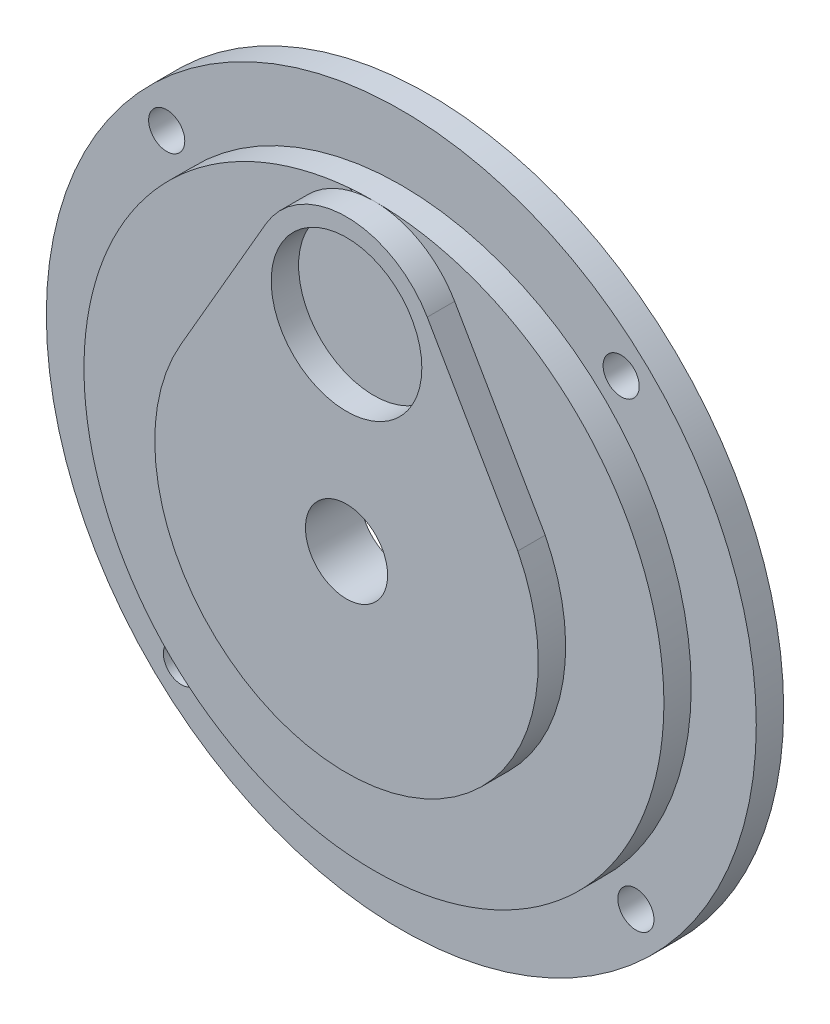
from build123d import *

# Parameters (mm, degrees)
SKETCH1_R           = 82.296
SKETCH1_R_2         = 57.15
SKETCH1_R_3         = 4.191
BOSS_EXTRUDE1_DEPTH = 6.35
SKETCH2_R           = 67.211414491
SKETCH2_R_2         = 9.525
BOSS_EXTRUDE2_DEPTH = 6.35
SKETCH3_R           = 9.525
SKETCH3_R_2         = 17.4625
BOSS_EXTRUDE3_DEPTH = 6.35
SKETCH4_R           = 2.15265
SKETCH4_R_2         = 2.169226356
CUT_EXTRUDE1_DEPTH  = 13.97


with BuildPart() as part:
    # Sketch1 → Boss-Extrude1 (new body)
    with BuildSketch(Plane.XY):
        with Locations((-43.673560496, 22.943742375)):
            Circle(SKETCH1_R)
        with Locations((-43.673560496, 22.943742375)):
            Circle(SKETCH1_R_2, mode=Mode.SUBTRACT)
        with Locations((-98.06108088, 73.910708897)):
            Circle(SKETCH1_R_3, mode=Mode.SUBTRACT)
        with Locations((7.293406026, 77.331262758)):
            Circle(SKETCH1_R_3, mode=Mode.SUBTRACT)
        with Locations((10.713959888, -28.023224148)):
            Circle(SKETCH1_R_3, mode=Mode.SUBTRACT)
        with Locations((-94.640527019, -31.443778009)):
            Circle(SKETCH1_R_3, mode=Mode.SUBTRACT)
    extrude(amount=BOSS_EXTRUDE1_DEPTH)

    # Sketch2 → Boss-Extrude2 (add)
    with BuildSketch(Plane.XY.offset(6.35)):
        with Locations((-43.673560496, 22.943742375)):
            Circle(SKETCH2_R)
        with Locations((-43.673560496, 22.943742375)):
            Circle(SKETCH2_R_2, mode=Mode.SUBTRACT)
    extrude(amount=BOSS_EXTRUDE2_DEPTH)

    # Sketch3 → Boss-Extrude3 (add)
    with BuildSketch(Plane.XY.offset(12.7)):
        with BuildLine():
            Line((-3.962770655, 42.915113639), (-24.961079117, 79.362585794))
            ThreePointArc((-24.961079117, 79.362585794), (-43.673560496, 90.155156865), (-62.386041875, 79.362585794))
            Line((-62.386041875, 79.362585794), (-82.148620619, 45.202948303))
            ThreePointArc((-82.148620619, 45.202948303), (-44.973677355, -21.487240016), (-3.962770655, 42.915113639))
        make_face()
        with Locations((-43.673560496, 22.943742375)):
            Circle(SKETCH3_R, mode=Mode.SUBTRACT)
        with Locations((-43.673560496, 68.536742375)):
            Circle(SKETCH3_R_2, mode=Mode.SUBTRACT)
    extrude(amount=BOSS_EXTRUDE3_DEPTH)

    # Sketch4 → Cut-Extrude1 (cut)
    with BuildSketch(Plane.XY.offset(12.7)):
        with Locations((-79.418759037, 43.581242375)):
            Circle(SKETCH4_R)
        with Locations((-7.928361955, 43.581242375)):
            Circle(SKETCH4_R_2)
        with Locations((-43.673560496, -18.331257625)):
            Circle(SKETCH4_R)
    extrude(amount=-CUT_EXTRUDE1_DEPTH, mode=Mode.SUBTRACT)


solid = part.part
